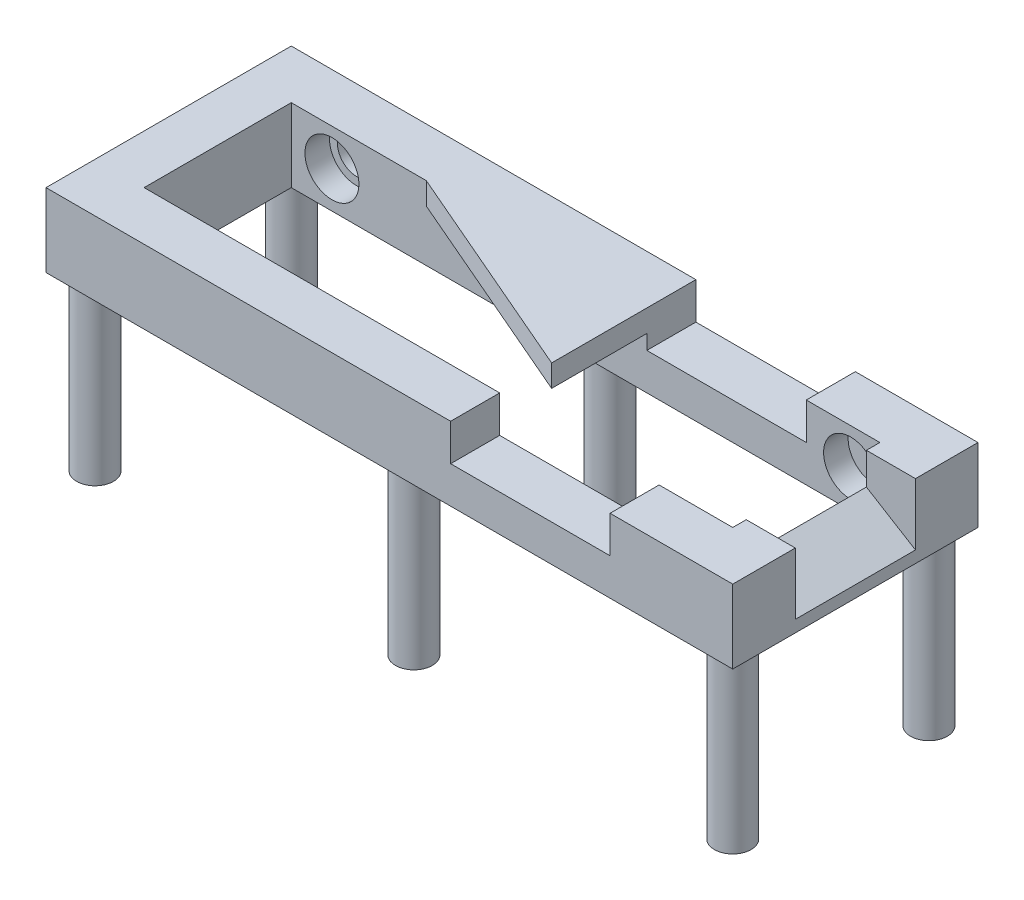
from build123d import *

# Parameters (mm, degrees)
IZIM1_W                          = 280
IZIM1_H                          = 100
IZIM1_W_2                        = 240
IZIM1_H_2                        = 60
Y_KSEKLIK_EKSTR_ZYON1_DEPTH      = 30
IZIM2_R                          = 7.5
Y_KSEKLIK_EKSTR_ZYON2_DEPTH      = 70
IZIM4_R                          = 11
KES_EKSTR_ZYON1_DEPTH            = 40
IZIM5_W                          = 65
IZIM5_H                          = 15
KES_EKSTR_ZYON2_DEPTH            = 119
KES_EKSTR_ZYON3_DEPTH            = 24.5
Y_KSEKLIK_EKSTR_ZYON4_DEPTH      = 8
Y_KSEKLIK_EKSTR_ZYON4_DEPTH_BACK = 1
IZIM13_R                         = 7.75
KES_EKSTR_ZYON4_DEPTH            = 18


with BuildPart() as part:
    # Çizim1 → Yükseklik-Ekstrüzyon1 (new body)
    with BuildSketch(Plane(origin=(0, 0, 0), x_dir=(1, 0, 0), z_dir=(0, 1, 0))):
        with Locations((120, 30)):
            Rectangle(IZIM1_W, IZIM1_H)
        with Locations((120, 30)):
            Rectangle(IZIM1_W_2, IZIM1_H_2, mode=Mode.SUBTRACT)
    extrude(amount=Y_KSEKLIK_EKSTR_ZYON1_DEPTH)

    # Çizim2 → Yükseklik-Ekstrüzyon2 (add)
    with BuildSketch(Plane(origin=(0, 0, 0), x_dir=(-1, 0, 0), z_dir=(0, -1, 0))):
        with Locations(Location((10, -10, 0), (0, 0, 90))):
            Circle(IZIM2_R)
        with Locations(Location((-250, -10, 0), (0, 0, 270))):
            Circle(IZIM2_R)
        with Locations(Location((10, 70, 0), (0, 0, 270))):
            Circle(IZIM2_R)
        with Locations(Location((-250, 70, 0), (0, 0, 90))):
            Circle(IZIM2_R)
        with Locations(Location((-120, -10, 0), (0, 0, 90))):
            Circle(IZIM2_R)
        with Locations(Location((-120, 70, 0), (0, 0, 90))):
            Circle(IZIM2_R)
    extrude(amount=Y_KSEKLIK_EKSTR_ZYON2_DEPTH)

    # Çizim4 → Kes-Ekstrüzyon1 (cut, symmetric)
    with BuildSketch(Plane.XY.offset(-30)):
        with Locations((228.036930768, 15)):
            Circle(IZIM4_R)
        with Locations((16.579541137, 15)):
            Circle(IZIM4_R)
        with Locations((95.469880506, 15)):
            Circle(IZIM4_R)
    extrude(amount=KES_EKSTR_ZYON1_DEPTH, both=True, mode=Mode.SUBTRACT)

    # Çizim5 → Kes-Ekstrüzyon2 (cut)
    with BuildSketch(Plane.XY.offset(20)):
        with Locations((177.478221097, 22.5)):
            Rectangle(IZIM5_W, IZIM5_H)
    extrude(amount=-KES_EKSTR_ZYON2_DEPTH, mode=Mode.SUBTRACT)

    # Çizim6 → Kes-Ekstrüzyon3 (cut, symmetric)
    with BuildSketch(Plane.XY.offset(-30)):
        Polygon((260, 31.552276972), (234.133246527, 31.552276972), (234.359911555, 20.467639669), (260, 4.801073138), align=None)
    extrude(amount=KES_EKSTR_ZYON3_DEPTH, both=True, mode=Mode.SUBTRACT)

    # Çizim10 → Yükseklik-Ekstrüzyon4 (add, two sides: drawn at the far end of the back side and taken through both)
    with BuildSketch(Plane(origin=(0, 22, 0), x_dir=(1, 0, 0), z_dir=(0, 1, 0)).offset(-Y_KSEKLIK_EKSTR_ZYON4_DEPTH_BACK)):
        Polygon((55.057032044, 60), (144.978221097, 21.175943648), (144.978221097, 60), align=None)
    extrude(amount=Y_KSEKLIK_EKSTR_ZYON4_DEPTH + Y_KSEKLIK_EKSTR_ZYON4_DEPTH_BACK)

    # Çizim13 → Kes-Ekstrüzyon4 (cut)
    with BuildSketch(Plane(origin=(0, 0, -80), x_dir=(-1, 0, 0), z_dir=(0, 0, -1))):
        with Locations((-16.579541137, 15)):
            Circle(IZIM13_R)
    extrude(amount=-KES_EKSTR_ZYON4_DEPTH, mode=Mode.SUBTRACT)


solid = part.part
